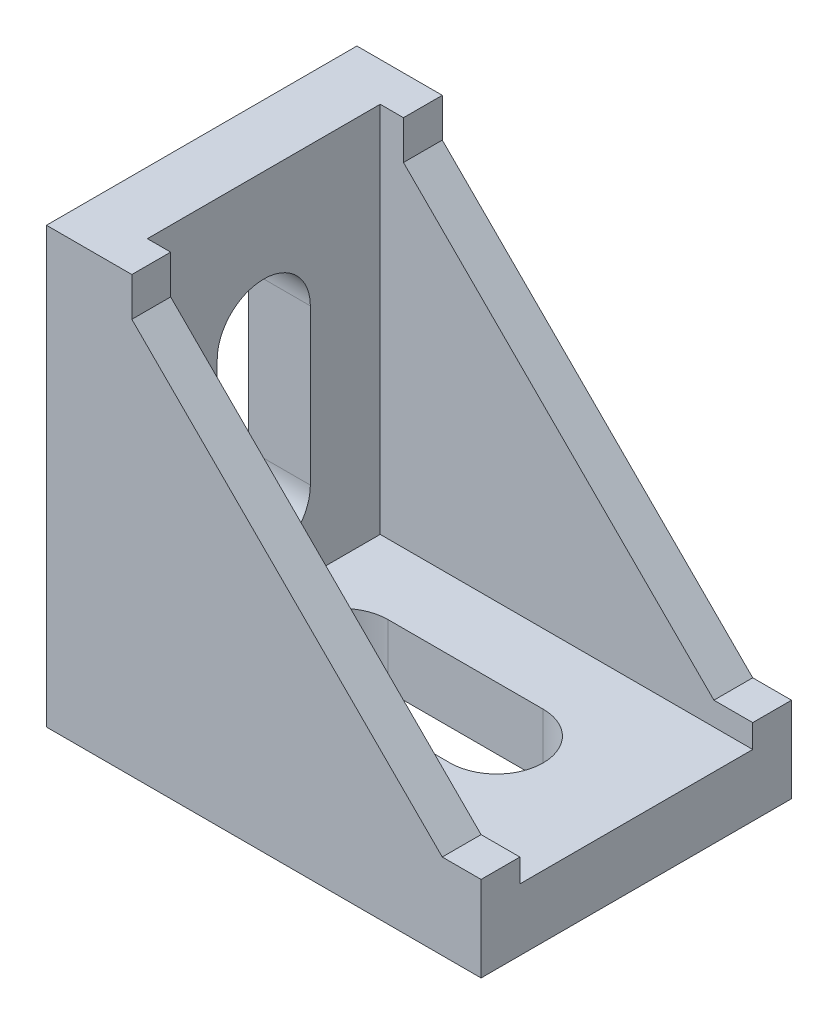
from build123d import *

# Parameters (mm, degrees)
SKETCH1_W           = 28
SKETCH1_H           = 28
BOSS_EXTRUDE1_DEPTH = 20
CUT_EXTRUDE1_DEPTH  = 45.362146026
CUT_EXTRUDE2_REACH  = 43.952
SKETCH3_W           = 15
SKETCH3_H           = 26.880949604
CUT_EXTRUDE3_DEPTH  = 4
CUT_EXTRUDE4_DEPTH  = 4
SKETCH6_W           = 5.8
SKETCH6_H           = 1
BOSS_EXTRUDE2_DEPTH = 1
SKETCH7_W           = 1
SKETCH7_H           = 5.8
BOSS_EXTRUDE3_DEPTH = 1


with BuildPart() as part:
    # Sketch1 → Boss-Extrude1 (new body)
    with BuildSketch(Plane.XY):
        with Locations((14, 14)):
            Rectangle(SKETCH1_W, SKETCH1_H)
    extrude(amount=BOSS_EXTRUDE1_DEPTH)

    # Sketch2 → Cut-Extrude1 (cut, through all)
    with BuildSketch(Plane.XY.offset(20)):
        Polygon((5.5, 29.426142622), (5.5, 25.5), (25.5, 5.5), (30.244346823, 5.5), (30.244346823, 29.426142622), align=None)
    extrude(amount=-CUT_EXTRUDE1_DEPTH, mode=Mode.SUBTRACT)

    # Cut-Extrude2: up to this face of the body (flat: up to its plane)
    cut_extrude2_end = Plane(part.part.faces().sort_by_distance((28, 2.75, 10))[0])
    # Sketch3 → Cut-Extrude2 (cut, up to the picked face)
    with BuildSketch(Plane.ZY.offset(-4), mode=Mode.PRIVATE) as cut_extrude2_sk1:
        with Locations((10, 17.440474802)):
            Rectangle(SKETCH3_W, SKETCH3_H)
    cut_extrude2_tool1 = split(extrude(cut_extrude2_sk1.sketch, amount=-CUT_EXTRUDE2_REACH, mode=Mode.PRIVATE), bisect_by=cut_extrude2_end, keep=Keep.BOTH, mode=Mode.PRIVATE)
    add(cut_extrude2_tool1.solids().sort_by(Axis((4, 17.440475, 10), (1, 0, 0)))[0], mode=Mode.SUBTRACT)

    # Sketch4 → Cut-Extrude3 (cut)
    with BuildSketch(Plane(origin=(4, 0, 0), x_dir=(0, 0, -1), z_dir=(1, 0, 0))):
        with BuildLine():
            Line((-13, 19), (-13, 9))
            ThreePointArc((-13, 9), (-10, 6), (-7, 9))
            Line((-7, 9), (-7, 19))
            ThreePointArc((-7, 19), (-10, 22), (-13, 19))
        make_face()
    extrude(amount=-CUT_EXTRUDE3_DEPTH, mode=Mode.SUBTRACT)

    # Sketch5 → Cut-Extrude4 (cut)
    with BuildSketch(Plane(origin=(0, 4, 0), x_dir=(1, 0, 0), z_dir=(0, 1, 0))):
        with BuildLine():
            Line((19, -13), (9, -13))
            ThreePointArc((9, -13), (6, -10), (9, -7))
            Line((9, -7), (19, -7))
            ThreePointArc((19, -7), (22, -10), (19, -13))
        make_face()
    extrude(amount=-CUT_EXTRUDE4_DEPTH, mode=Mode.SUBTRACT)

    # Sketch6 → Boss-Extrude2 (add)
    with BuildSketch(Plane.ZY):
        with Locations((10, 26.5)):
            Rectangle(SKETCH6_W, SKETCH6_H)
    extrude(amount=BOSS_EXTRUDE2_DEPTH)

    # Sketch7 → Boss-Extrude3 (add)
    with BuildSketch(Plane.XZ):
        with Locations((26.5, 10)):
            Rectangle(SKETCH7_W, SKETCH7_H)
    extrude(amount=BOSS_EXTRUDE3_DEPTH)


solid = part.part
